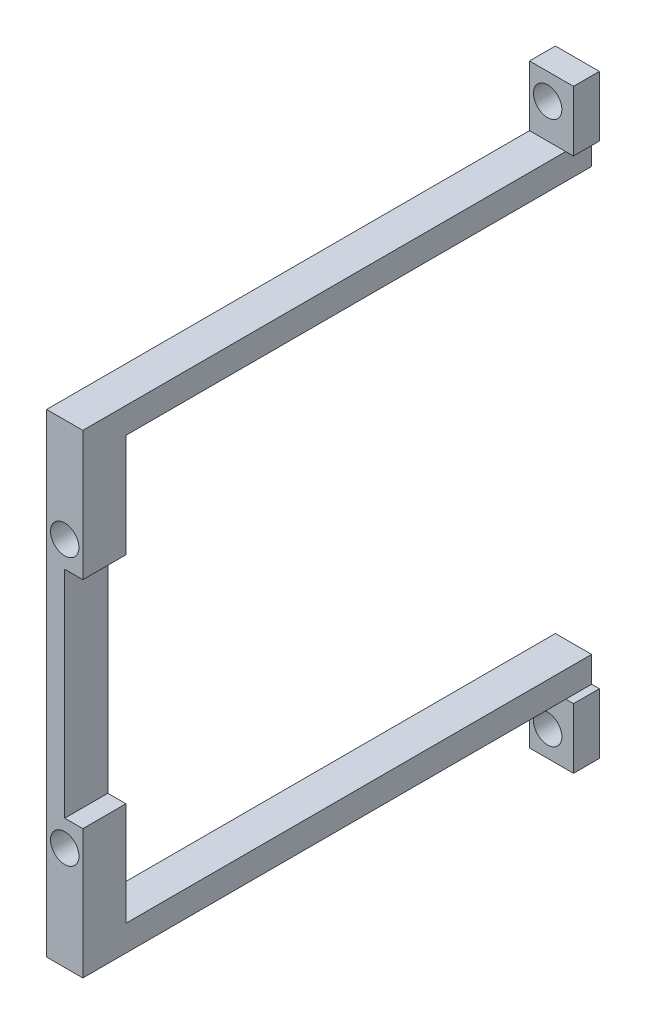
from build123d import *

# Parameters (mm, degrees)
SKETCH_1_W          = 4.2
SKETCH_1_H          = 49
EXTRUDE_1_DEPTH     = 5
SKETCH_5_R          = 1.65
CUT_EXTRUDE_2_DEPTH = 5
SKETCH_6_W          = 4.2
SKETCH_6_H          = 3
EXTRUDE_2_DEPTH     = 59
SKETCH_11_R         = 1.65
EXTRUDE_3_DEPTH     = 3
SKETCH_12_W         = 6.956074108
SKETCH_12_H         = 25
CUT_EXTRUDE_3_DEPTH = 10


with BuildPart() as part:
    # 草图1 → 凸台-拉伸1 (new body)
    with BuildSketch(Plane.XY):
        with Locations((2.1, -24.5)):
            Rectangle(SKETCH_1_W, SKETCH_1_H)
    extrude(amount=EXTRUDE_1_DEPTH)

    # 草图5 → 切除-拉伸2 (cut)
    with BuildSketch(Plane.XY.offset(5)):
        with Locations((2.1, -9)):
            Circle(SKETCH_5_R)
        with Locations(Location((2.1, -40, 0), (0, 0, 180))):
            Circle(SKETCH_5_R)
    extrude(amount=-CUT_EXTRUDE_2_DEPTH, mode=Mode.SUBTRACT)

    # 草图6 → 凸台-拉伸2 (add)
    with BuildSketch(Plane.XY.offset(5)):
        with Locations((2.1, -50.5)):
            Rectangle(SKETCH_6_W, SKETCH_6_H)
        with Locations((2.1, 1.5)):
            Rectangle(SKETCH_6_W, SKETCH_6_H)
    extrude(amount=-EXTRUDE_2_DEPTH)

    # 草图11 → 凸台-拉伸3 (add)
    # profile 1 of 2: a face of its own
    with BuildSketch(Plane(origin=(0, 0, -54), x_dir=(-1, 0, 0), z_dir=(0, 0, -1))):
        Polygon((-2.1, 3), (-5.1, 3), (-5.1, 10), (0, 10), (0, 3), align=None)
        with Locations((-2.1, 7)):
            Circle(SKETCH_11_R, mode=Mode.SUBTRACT)
    # profile 2 of 2: a face of its own
    with BuildSketch(Plane(origin=(0, 0, -54), x_dir=(-1, 0, 0), z_dir=(0, 0, -1))):
        Polygon((0, -59), (-5.1, -59), (-5.1, -52), (-2.1, -52), (0, -52), align=None)
        with Locations(Location((-2.1, -56, 0), (0, 0, 180))):
            Circle(SKETCH_11_R, mode=Mode.SUBTRACT)
    extrude(amount=-EXTRUDE_3_DEPTH)

    # 草图12 → 切除-拉伸3 (cut)
    with BuildSketch(Plane.XY.offset(5)):
        with Locations((5.578037054, -24.5)):
            Rectangle(SKETCH_12_W, SKETCH_12_H)
    extrude(amount=-CUT_EXTRUDE_3_DEPTH, mode=Mode.SUBTRACT)


solid = part.part
